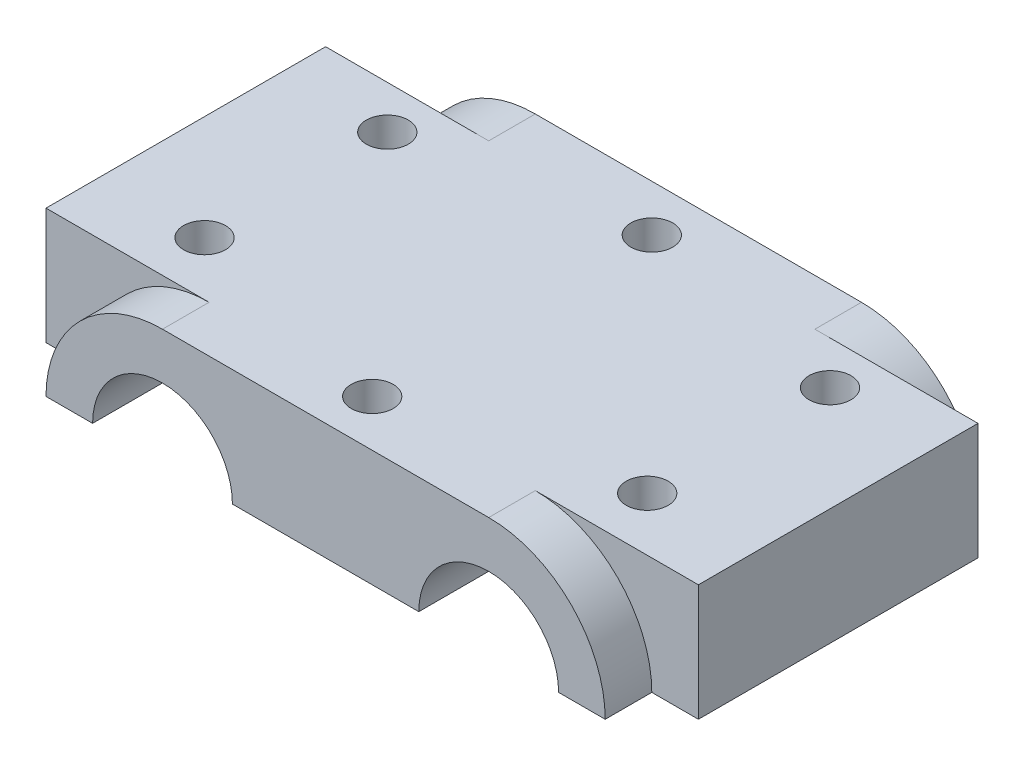
from build123d import *

# Parameters (mm, degrees)
SKETCH1_W                = 70
SKETCH1_H                = 12.5
BOSS_EXTRUDE1_DEPTH      = 30
BOSS_EXTRUDE3_DEPTH      = 5
BOSS_EXTRUDE3_DEPTH_BACK = 35
CUT_EXTRUDE1_START       = -66
CUT_EXTRUDE1_DEPTH       = 66
SKETCH7_R                = 2.25
CUT_EXTRUDE2_DEPTH       = 66


with BuildPart() as part:
    # Sketch1 → Boss-Extrude1 (new body)
    with BuildSketch(Plane.XY):
        Rectangle(SKETCH1_W, SKETCH1_H)
    extrude(amount=-BOSS_EXTRUDE1_DEPTH)

    # Sketch2 → Boss-Extrude3 (add, two sides: drawn at the far end of the back side and taken through both)
    with BuildSketch(Plane.XY.offset(-BOSS_EXTRUDE3_DEPTH_BACK)):
        with BuildLine():
            Line((-10, -6.25), (10, -6.25))
            ThreePointArc((10, -6.25), (17.5, 1.25), (25, -6.25))
            Line((25, -6.25), (30, -6.25))
            ThreePointArc((30, -6.25), (26.338834765, 2.588834765), (17.5, 6.25))
            Line((17.5, 6.25), (-17.5, 6.25))
            ThreePointArc((-17.5, 6.25), (-26.338834765, 2.588834765), (-30, -6.25))
            Line((-30, -6.25), (-25, -6.25))
            ThreePointArc((-25, -6.25), (-17.5, 1.25), (-10, -6.25))
        make_face()
    extrude(amount=BOSS_EXTRUDE3_DEPTH + BOSS_EXTRUDE3_DEPTH_BACK)

    # Sketch5 → Cut-Extrude1 (cut)
    with BuildSketch(Plane.XY.offset(5).offset(CUT_EXTRUDE1_START)):
        with BuildLine():
            Line((-25, -6.25), (-10, -6.25))
            ThreePointArc((-10, -6.25), (-17.5, 1.25), (-25, -6.25))
        make_face()
        with BuildLine():
            Line((10, -6.25), (25, -6.25))
            ThreePointArc((25, -6.25), (17.5, 1.25), (10, -6.25))
        make_face()
    extrude(amount=CUT_EXTRUDE1_DEPTH, mode=Mode.SUBTRACT)

    # Sketch7 → Cut-Extrude2 (cut)
    with BuildSketch(Plane(origin=(0, 6.25, 0), x_dir=(1, 0, 0), z_dir=(0, 1, 0))):
        with Locations(Location((0, 0, 0), (0, 0, 270))):
            Circle(SKETCH7_R)
        with Locations(Location((0, 30, 0), (0, 0, 270))):
            Circle(SKETCH7_R)
        with Locations(Location((23.75, 25.372099054, 0), (0, 0, 270))):
            Circle(SKETCH7_R)
        with Locations(Location((23.75, 5.759402661, 0), (0, 0, 270))):
            Circle(SKETCH7_R)
        with Locations(Location((-23.75, 25.372099054, 0), (0, 0, 236.251011404))):
            Circle(SKETCH7_R)
        with Locations(Location((-23.75, 5.759402661, 0), (0, 0, 236.251011404))):
            Circle(SKETCH7_R)
    extrude(amount=-CUT_EXTRUDE2_DEPTH, mode=Mode.SUBTRACT)


solid = part.part
